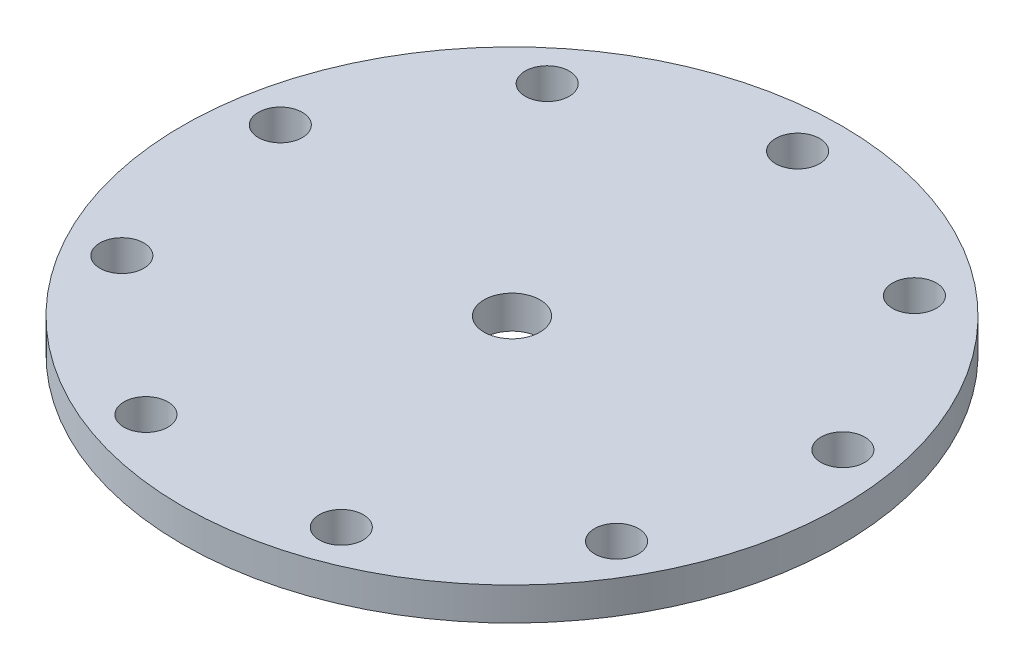
from build123d import *

# Parameters (mm, degrees)
SKETCH_1_R      = 60
SKETCH_1_R_2    = 4
SKETCH_1_R_3    = 5.1
EXTRUDE_1_DEPTH = 6


with BuildPart() as part:
    # 草图1 → 凸台-拉伸1 (new body)
    with BuildSketch(Plane(origin=(0, 0, 0), x_dir=(1, 0, 0), z_dir=(0, 1, 0))):
        with Locations(Location((0, 0, 0), (0, 0, 270))):
            Circle(SKETCH_1_R)
        with Locations(Location((0, 52, 0), (0, 0, 270))):
            Circle(SKETCH_1_R_2, mode=Mode.SUBTRACT)
        with Locations(Location((33.424955704, 39.834311042, 0), (0, 0, 270))):
            Circle(SKETCH_1_R_2, mode=Mode.SUBTRACT)
        with Locations(Location((51.210003157, 9.029705239, 0), (0, 0, 270))):
            Circle(SKETCH_1_R_2, mode=Mode.SUBTRACT)
        with Locations(Location((45.033320997, -26, 0), (0, 0, 270))):
            Circle(SKETCH_1_R_2, mode=Mode.SUBTRACT)
        with Locations(Location((17.785047453, -48.864016281, 0), (0, 0, 270))):
            Circle(SKETCH_1_R_2, mode=Mode.SUBTRACT)
        with Locations(Location((-17.785047453, -48.864016281, 0), (0, 0, 270))):
            Circle(SKETCH_1_R_2, mode=Mode.SUBTRACT)
        with Locations(Location((-45.033320997, -26, 0), (0, 0, 270))):
            Circle(SKETCH_1_R_2, mode=Mode.SUBTRACT)
        with Locations(Location((-51.210003157, 9.029705239, 0), (0, 0, 270))):
            Circle(SKETCH_1_R_2, mode=Mode.SUBTRACT)
        with Locations(Location((-33.424955704, 39.834311042, 0), (0, 0, 270))):
            Circle(SKETCH_1_R_2, mode=Mode.SUBTRACT)
        with Locations(Location((0, 0, 0), (0, 0, 270))):
            Circle(SKETCH_1_R_3, mode=Mode.SUBTRACT)
    extrude(amount=EXTRUDE_1_DEPTH)


solid = part.part
